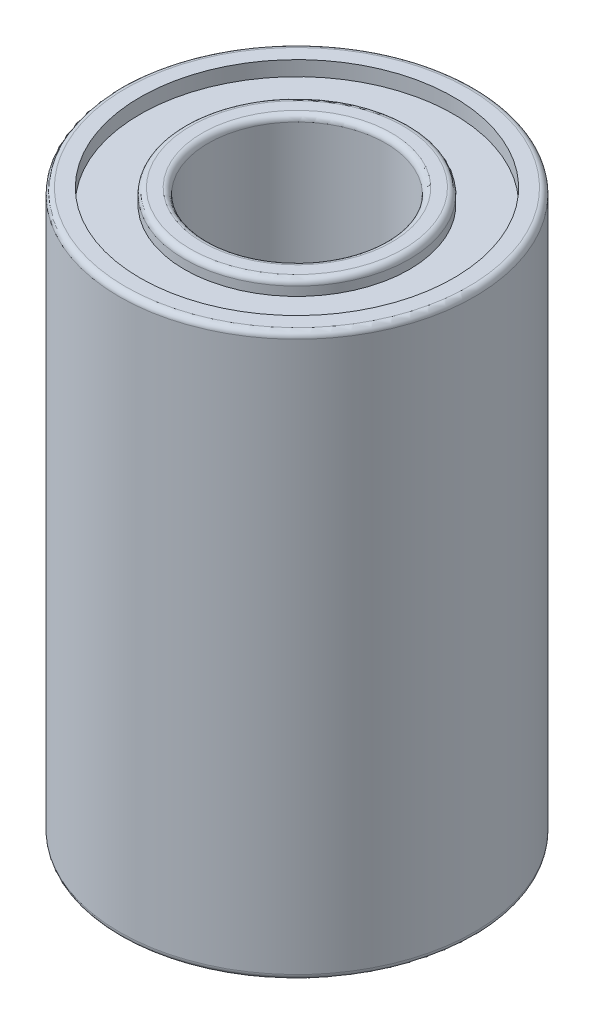
from build123d import *

# Parameters (mm, degrees)
SKETCH1_R           = 6
SKETCH1_R_2         = 3
BOSS_EXTRUDE1_DEPTH = 19
SKETCH2_R           = 5.3
SKETCH2_R_2         = 3.8
CUT_EXTRUDE1_DEPTH  = 0.5
CUT_EXTRUDE2_START  = -0.5
SKETCH3_R           = 5.3
SKETCH3_R_2         = 3.8
CUT_EXTRUDE2_DEPTH  = 0.5
FILLET1_R           = 0.2


with BuildPart() as part:
    # Sketch1 → Boss-Extrude1 (new body)
    with BuildSketch(Plane(origin=(0, 0, 0), x_dir=(1, 0, 0), z_dir=(0, 1, 0))):
        with Locations(Location((0, 0, 0), (0, 0, 270))):
            Circle(SKETCH1_R)
        with Locations(Location((0, 0, 0), (0, 0, 270))):
            Circle(SKETCH1_R_2, mode=Mode.SUBTRACT)
    extrude(amount=BOSS_EXTRUDE1_DEPTH)

    # Sketch2 → Cut-Extrude1 (cut)
    with BuildSketch(Plane(origin=(0, 19, 0), x_dir=(1, 0, 0), z_dir=(0, 1, 0))):
        with Locations(Location((0, 0, 0), (0, 0, 270))):
            Circle(SKETCH2_R)
        with Locations(Location((0, 0, 0), (0, 0, 270))):
            Circle(SKETCH2_R_2, mode=Mode.SUBTRACT)
    extrude(amount=-CUT_EXTRUDE1_DEPTH, mode=Mode.SUBTRACT)

    # Sketch3 → Cut-Extrude2 (cut)
    with BuildSketch(Plane.XZ.offset(CUT_EXTRUDE2_START)):
        with Locations(Location((0, 0, 0), (0, 0, 90))):
            Circle(SKETCH3_R)
        with Locations(Location((0, 0, 0), (0, 0, 90))):
            Circle(SKETCH3_R_2, mode=Mode.SUBTRACT)
    extrude(amount=CUT_EXTRUDE2_DEPTH, mode=Mode.SUBTRACT)

    # Fillet1
    fillet1_edges = [part.edges().sort_by_distance(p)[0] for p in [
        (0, 19, -3.8),
        (0, 0, -5.3),
        (0, 0, -3.8),
        (0, 0, -6),
        (0, 19, -6),
        (0, 0, -3),
        (0, 19, -3),
    ]]
    fillet(fillet1_edges, radius=FILLET1_R)


solid = part.part
